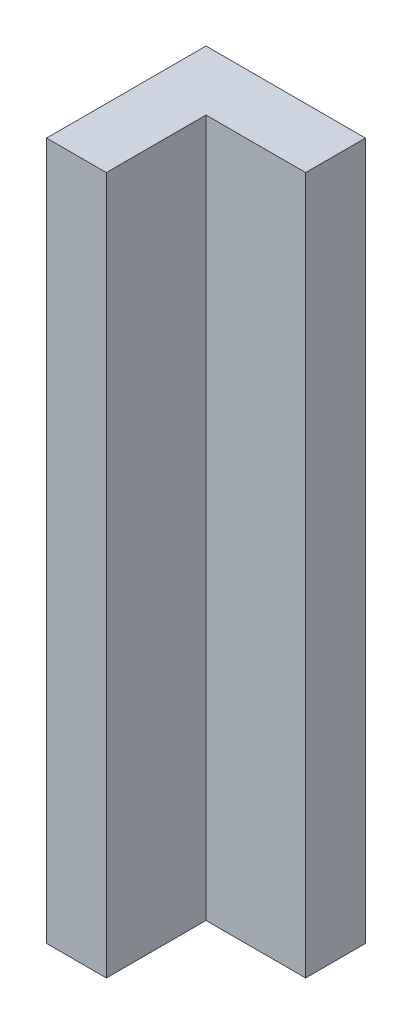
from build123d import *

# Parameters (mm, degrees)
BOSS_EXTRUDE1_DEPTH = 56


with BuildPart() as part:
    # Sketch1 → Boss-Extrude1 (new body)
    with BuildSketch(Plane(origin=(0, 0, 0), x_dir=(1, 0, 0), z_dir=(0, 1, 0))):
        Polygon((-7.113432836, 6.665671642), (-7.113432836, -6.134328358), (-2.313432836, -6.134328358), (-2.313432836, 1.865671642), (5.686567164, 1.865671642), (5.686567164, 6.665671642), align=None)
    extrude(amount=BOSS_EXTRUDE1_DEPTH)


solid = part.part
